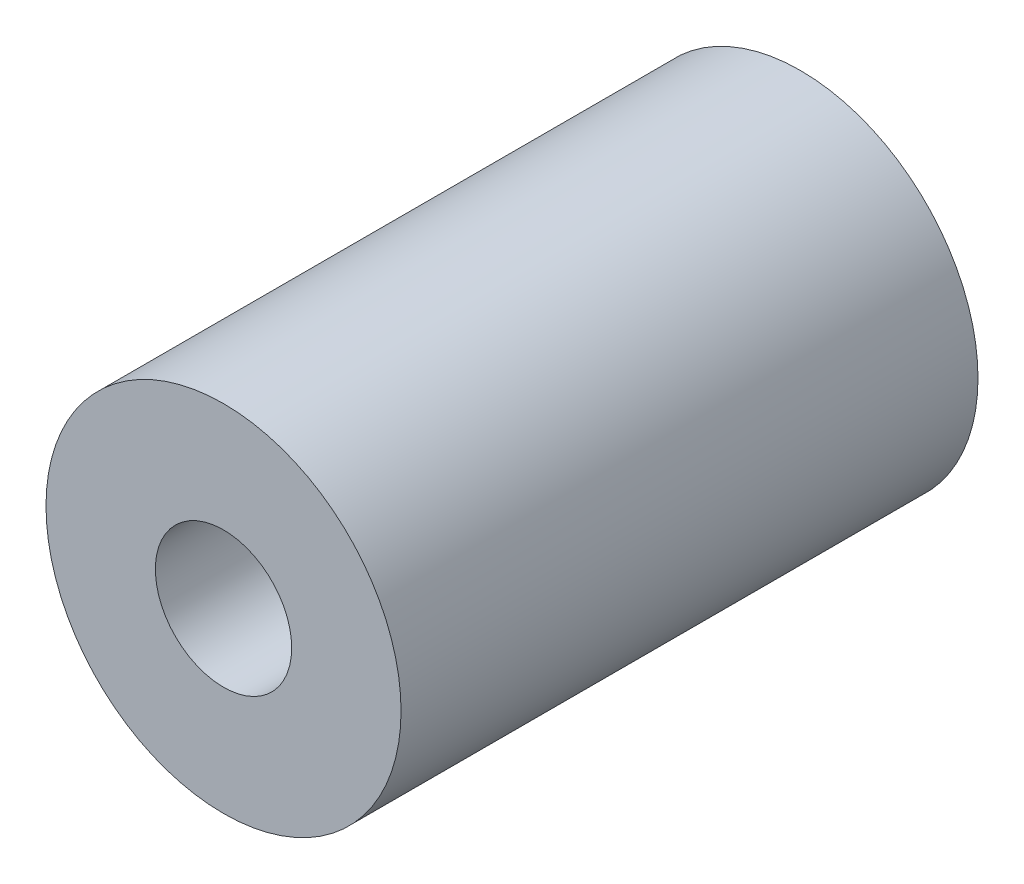
from build123d import *

# Parameters (mm, degrees)
SKETCH1_R      = 6.35
SKETCH1_R_2    = 2.4384
EXTRUDE1_DEPTH = 10.31875


with BuildPart() as part:
    # Sketch1 → Extrude1 (new, symmetric)
    with BuildSketch(Plane.XY):
        Circle(SKETCH1_R)
        Circle(SKETCH1_R_2, mode=Mode.SUBTRACT)
    extrude(amount=EXTRUDE1_DEPTH, both=True)


solid = part.part
